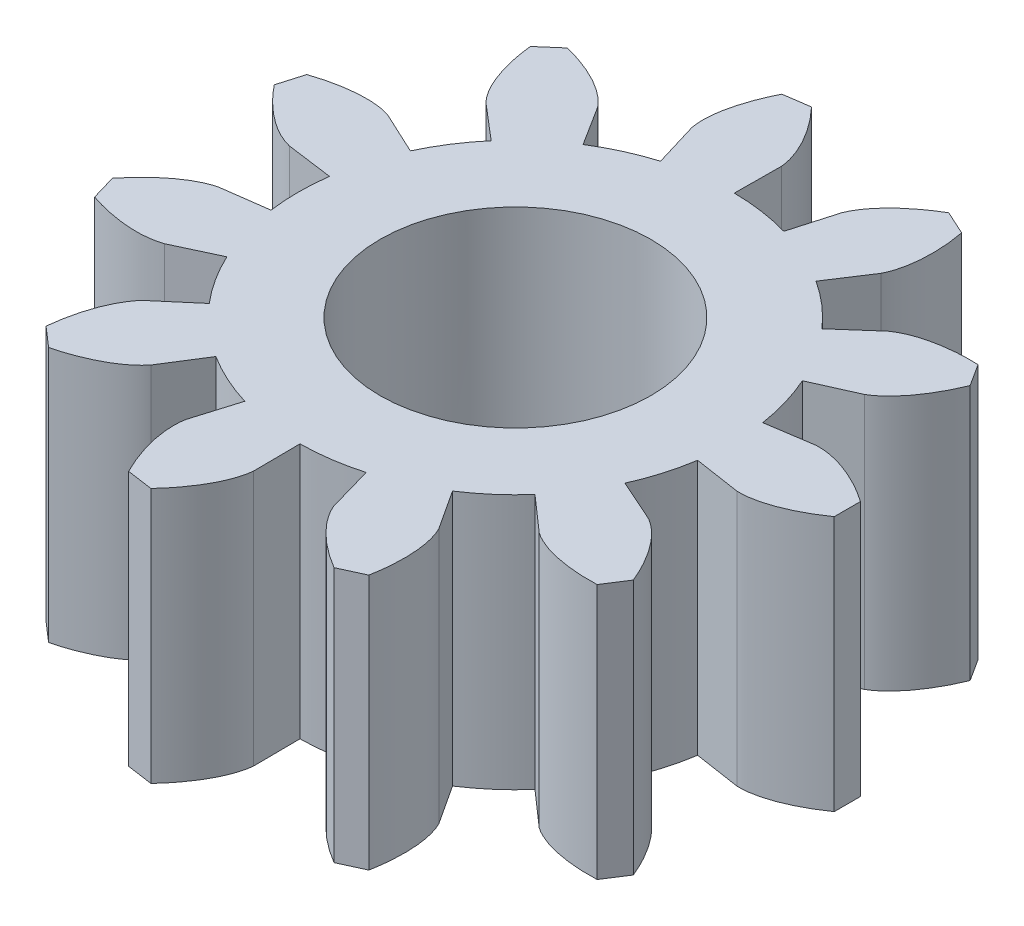
from build123d import *

# Parameters (mm, degrees)
BOSS_EXTRUDE1_DEPTH     = 5
CUT_EXTRUDE1_DEPTH      = 11.43956726
CUT_EXTRUDE1_DEPTH_BACK = 11.43956726
SKETCH2_R               = 2.65


with BuildPart() as part:
    # Sketch1 → Boss-Extrude1 (new body)
    with BuildSketch(Plane.XZ.offset(5)):
        with BuildLine():
            Line((3.190229537, -2.808012732), (3.879551376, -3.414747915))
            add(Edge.make_bspline(
                [(3.879551376, -3.414747915), (4.371081204, -3.768547035), (5.325327031, -3.7270487)],
                knots=[3.664389894, 3.664389894, 3.664389894, 4.719659584, 4.719659584, 4.719659584], degree=2, weights=[1, 0.864000321, 1]))
            Line((5.325327031, -3.7270487), (5.602463544, -3.295815869))
            add(Edge.make_bspline(
                [(5.602463544, -3.295815869), (5.243842932, -2.409552511), (4.717787845, -2.11042651)],
                knots=[1.542822379, 1.542822379, 1.542822379, 2.616695251, 2.616695251, 2.616695251], degree=2, weights=[1, 0.859279742, 1]))
            Line((4.717787845, -2.11042651), (3.879527469, -1.735444214))
            ThreePointArc((3.879527469, -1.735444214), (4.077845138, -1.197363367), (4.201918167, -0.637482326))
            Line((4.201918167, -0.637482326), (5.109838405, -0.775224919))
            add(Edge.make_bspline(
                [(5.109838405, -0.775224919), (5.714617855, -0.807118591), (6.494944834, -0.256303727)],
                knots=[3.664389894, 3.664389894, 3.664389894, 4.719659584, 4.719659584, 4.719659584], degree=2, weights=[1, 0.864000321, 1]))
            Line((6.494944834, -0.256303727), (6.494944834, 0.256303727))
            add(Edge.make_bspline(
                [(6.494944834, 0.256303727), (5.714103832, 0.807990967), (5.109838405, 0.775224919)],
                knots=[1.542822379, 1.542822379, 1.542822379, 2.616695251, 2.616695251, 2.616695251], degree=2, weights=[1, 0.859279742, 1]))
            Line((5.109838405, 0.775224919), (4.201918167, 0.637482326))
            ThreePointArc((4.201918167, 0.637482326), (4.077845138, 1.197363367), (3.879527469, 1.735444214))
            Line((3.879527469, 1.735444214), (4.717787845, 2.11042651))
            add(Edge.make_bspline(
                [(4.717787845, 2.11042651), (5.243803714, 2.410564302), (5.602463544, 3.295815869)],
                knots=[0.52279724, 0.52279724, 0.52279724, 1.57806693, 1.57806693, 1.57806693], degree=2, weights=[1, 0.864000321, 1]))
            Line((5.602463544, 3.295815869), (5.325327031, 3.7270487))
            add(Edge.make_bspline(
                [(5.325327031, 3.7270487), (4.370177139, 3.769003022), (3.879551376, 3.414747915)],
                knots=[1.542822379, 1.542822379, 1.542822379, 2.616695251, 2.616695251, 2.616695251], degree=2, weights=[1, 0.859279742, 1]))
            Line((3.879551376, 3.414747915), (3.190229537, 2.808012732))
            ThreePointArc((3.190229537, 2.808012732), (2.783158119, 3.211935691), (2.32541421, 3.557379478))
            Line((2.32541421, 3.557379478), (2.827872978, 4.326032434))
            add(Edge.make_bspline(
                [(2.827872978, 4.326032434), (3.108118945, 4.862910062), (2.931239663, 5.801537213)],
                knots=[0.52279724, 0.52279724, 0.52279724, 1.57806693, 1.57806693, 1.57806693], degree=2, weights=[1, 0.864000321, 1]))
            Line((2.931239663, 5.801537213), (2.464955522, 6.014482045))
            add(Edge.make_bspline(
                [(2.464955522, 6.014482045), (1.638750082, 5.533383248), (1.417534197, 4.970112574)],
                knots=[1.542822379, 1.542822379, 1.542822379, 2.616695251, 2.616695251, 2.616695251], degree=2, weights=[1, 0.859279742, 1]))
            Line((1.417534197, 4.970112574), (1.16566557, 4.087018936))
            ThreePointArc((1.16566557, 4.087018936), (0.604838063, 4.206741128), (0.032998371, 4.249871893))
            Line((0.032998371, 4.249871893), (0.040128421, 5.168153627))
            add(Edge.make_bspline(
                [(0.040128421, 5.168153627), (-0.014371628, 5.771316237), (-0.670632099, 6.465311484)],
                knots=[0.52279724, 0.52279724, 0.52279724, 1.57806693, 1.57806693, 1.57806693], degree=2, weights=[1, 0.864000321, 1]))
            Line((-0.670632099, 6.465311484), (-1.178021948, 6.392359837))
            add(Edge.make_bspline(
                [(-1.178021948, 6.392359837), (-1.612968547, 5.54095339), (-1.494540074, 4.947501609)],
                knots=[4.684415032, 4.684415032, 4.684415032, 5.758287905, 5.758287905, 5.758287905], degree=2, weights=[1, 0.859279742, 1]))
            Line((-1.494540074, 4.947501609), (-1.22898898, 4.068425505))
            ThreePointArc((-1.22898898, 4.068425505), (-1.765513805, 3.86593598), (-2.269894218, 3.59306001))
            Line((-2.269894218, 3.59306001), (-2.760356625, 4.369422559))
            add(Edge.make_bspline(
                [(-2.760356625, 4.369422559), (-3.132299311, 4.847370285), (-4.059582909, 5.076395041)],
                knots=[0.52279724, 0.52279724, 0.52279724, 1.57806693, 1.57806693, 1.57806693], degree=2, weights=[1, 0.864000321, 1]))
            Line((-4.059582909, 5.076395041), (-4.446985774, 4.740708547))
            add(Edge.make_bspline(
                [(-4.446985774, 4.740708547), (-4.352581058, 3.789309981), (-3.932108431, 3.35409384)],
                knots=[4.684415032, 4.684415032, 4.684415032, 5.758287905, 5.758287905, 5.758287905], degree=2, weights=[1, 0.859279742, 1]))
            Line((-3.932108431, 3.35409384), (-3.233448212, 2.758135722))
            ThreePointArc((-3.233448212, 2.758135722), (-3.575327515, 2.297723474), (-3.852111431, 1.795476962))
            Line((-3.852111431, 1.795476962), (-4.684447947, 2.183430702))
            add(Edge.make_bspline(
                [(-4.684447947, 2.183430702), (-5.255744094, 2.384418517), (-6.159644828, 2.07575904)],
                knots=[0.52279724, 0.52279724, 0.52279724, 1.57806693, 1.57806693, 1.57806693], degree=2, weights=[1, 0.864000321, 1]))
            Line((-6.159644828, 2.07575904), (-6.304063037, 1.58391579))
            add(Edge.make_bspline(
                [(-6.304063037, 1.58391579), (-5.710279838, 0.834587427), (-5.121260145, 0.695784976)],
                knots=[4.684415032, 4.684415032, 4.684415032, 5.758287905, 5.758287905, 5.758287905], degree=2, weights=[1, 0.859279742, 1]))
            Line((-5.121260145, 0.695784976), (-4.211310483, 0.572157336))
            ThreePointArc((-4.211310483, 0.572157336), (-4.25, 0), (-4.211310483, -0.572157336))
            Line((-4.211310483, -0.572157336), (-5.121260145, -0.695784976))
            add(Edge.make_bspline(
                [(-5.121260145, -0.695784976), (-5.710527263, -0.835569283), (-6.304063037, -1.58391579)],
                knots=[3.664389894, 3.664389894, 3.664389894, 4.719659584, 4.719659584, 4.719659584], degree=2, weights=[1, 0.864000321, 1]))
            Line((-6.304063037, -1.58391579), (-6.159644828, -2.07575904))
            add(Edge.make_bspline(
                [(-6.159644828, -2.07575904), (-5.255005116, -2.385110738), (-4.684447947, -2.183430702)],
                knots=[4.684415032, 4.684415032, 4.684415032, 5.758287905, 5.758287905, 5.758287905], degree=2, weights=[1, 0.859279742, 1]))
            Line((-4.684447947, -2.183430702), (-3.852111431, -1.795476962))
            ThreePointArc((-3.852111431, -1.795476962), (-3.575327515, -2.297723474), (-3.233448212, -2.758135722))
            Line((-3.233448212, -2.758135722), (-3.932108431, -3.35409384))
            add(Edge.make_bspline(
                [(-3.932108431, -3.35409384), (-4.352258375, -3.790269739), (-4.446985774, -4.740708547)],
                knots=[3.664389894, 3.664389894, 3.664389894, 4.719659584, 4.719659584, 4.719659584], degree=2, weights=[1, 0.864000321, 1]))
            Line((-4.446985774, -4.740708547), (-4.059582909, -5.076395041))
            add(Edge.make_bspline(
                [(-4.059582909, -5.076395041), (-3.1313034, -4.847553096), (-2.760356625, -4.369422559)],
                knots=[4.684415032, 4.684415032, 4.684415032, 5.758287905, 5.758287905, 5.758287905], degree=2, weights=[1, 0.859279742, 1]))
            Line((-2.760356625, -4.369422559), (-2.269894218, -3.59306001))
            ThreePointArc((-2.269894218, -3.59306001), (-1.765513805, -3.86593598), (-1.22898898, -4.068425505))
            Line((-1.22898898, -4.068425505), (-1.494540074, -4.947501609))
            add(Edge.make_bspline(
                [(-1.494540074, -4.947501609), (-1.612178204, -5.541586333), (-1.178021948, -6.392359837)],
                knots=[3.664389894, 3.664389894, 3.664389894, 4.719659584, 4.719659584, 4.719659584], degree=2, weights=[1, 0.864000321, 1]))
            Line((-1.178021948, -6.392359837), (-0.670632099, -6.465311484))
            add(Edge.make_bspline(
                [(-0.670632099, -6.465311484), (-0.013434979, -5.770931598), (0.040128421, -5.168153627)],
                knots=[1.542822379, 1.542822379, 1.542822379, 2.616695251, 2.616695251, 2.616695251], degree=2, weights=[1, 0.859279742, 1]))
            Line((0.040128421, -5.168153627), (0.032998371, -4.249871893))
            ThreePointArc((0.032998371, -4.249871893), (0.604838063, -4.206741128), (1.16566557, -4.087018936))
            Line((1.16566557, -4.087018936), (1.417534197, -4.970112574))
            add(Edge.make_bspline(
                [(1.417534197, -4.970112574), (1.639757156, -5.533488422), (2.464955522, -6.014482045)],
                knots=[3.664389894, 3.664389894, 3.664389894, 4.719659584, 4.719659584, 4.719659584], degree=2, weights=[1, 0.864000321, 1]))
            Line((2.464955522, -6.014482045), (2.931239663, -5.801537213))
            add(Edge.make_bspline(
                [(2.931239663, -5.801537213), (3.108698953, -4.862080092), (2.827872978, -4.326032434)],
                knots=[1.542822379, 1.542822379, 1.542822379, 2.616695251, 2.616695251, 2.616695251], degree=2, weights=[1, 0.859279742, 1]))
            Line((2.827872978, -4.326032434), (2.32541421, -3.557379478))
            ThreePointArc((2.32541421, -3.557379478), (2.783158119, -3.211935691), (3.190229537, -2.808012732))
        make_face()
    extrude(amount=-BOSS_EXTRUDE1_DEPTH)

    # Sketch2 → Cut-Extrude1 (cut, two sides: drawn at the far end of the back side and taken through both)
    with BuildSketch(Plane(origin=(0, 0, 0), x_dir=(1, 0, 0), z_dir=(0, 1, 0)).offset(-CUT_EXTRUDE1_DEPTH_BACK)):
        with Locations(Location((0, 0, 0), (0, 0, 270))):
            Circle(SKETCH2_R)
    extrude(amount=CUT_EXTRUDE1_DEPTH + CUT_EXTRUDE1_DEPTH_BACK, mode=Mode.SUBTRACT)


solid = part.part
